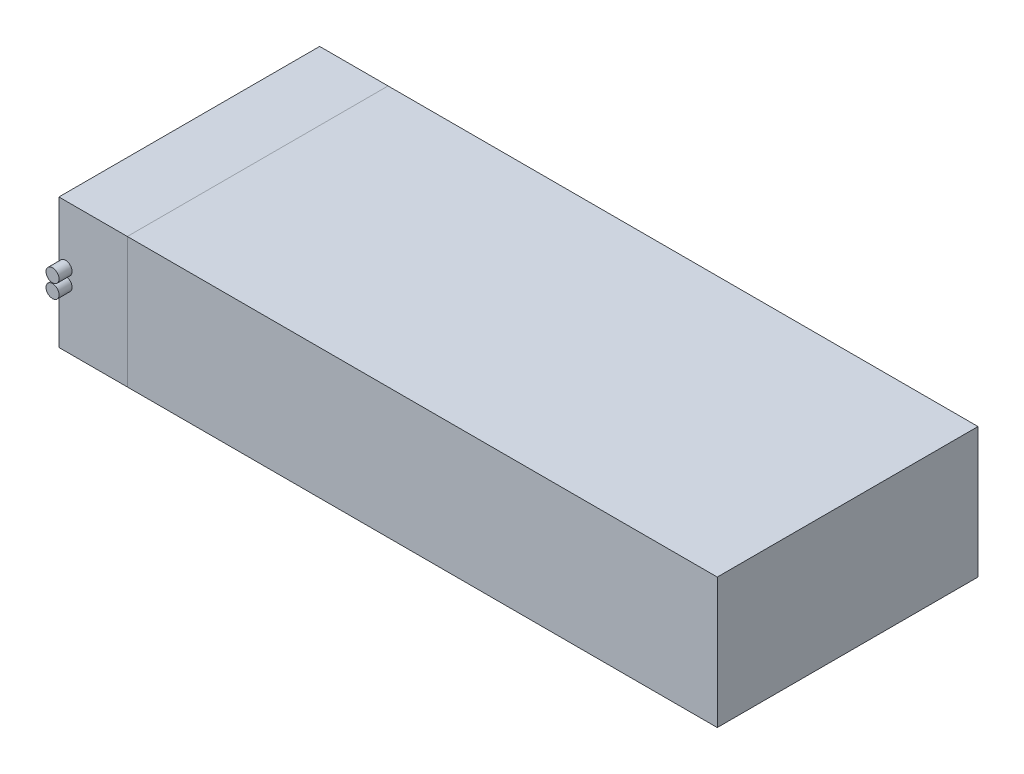
from build123d import *

# Parameters (mm, degrees)
SKETCH1_W           = 50.5
SKETCH1_H           = 20
BOSS_EXTRUDE1_DEPTH = 10
SKETCH3_R           = 0.5
BOSS_EXTRUDE7_DEPTH = 1


with BuildPart() as part:
    # Sketch1 → Boss-Extrude1 (new body)
    with BuildSketch(Plane(origin=(0, 0, 0), x_dir=(1, 0, 0), z_dir=(0, 1, 0))):
        with Locations((25.25, 10)):
            Rectangle(SKETCH1_W, SKETCH1_H)
    extrude(amount=BOSS_EXTRUDE1_DEPTH)

    # Sketch3 → Boss-Extrude7 (add)
    with BuildSketch(Plane.XY):
        with Locations(Location((0.51, 5.55, 0), (0, 0, 180))):
            Circle(SKETCH3_R)
        with Locations(Location((0.51, 4.5, 0), (0, 0, 180))):
            Circle(SKETCH3_R)
    extrude(amount=BOSS_EXTRUDE7_DEPTH)


solid = part.part
